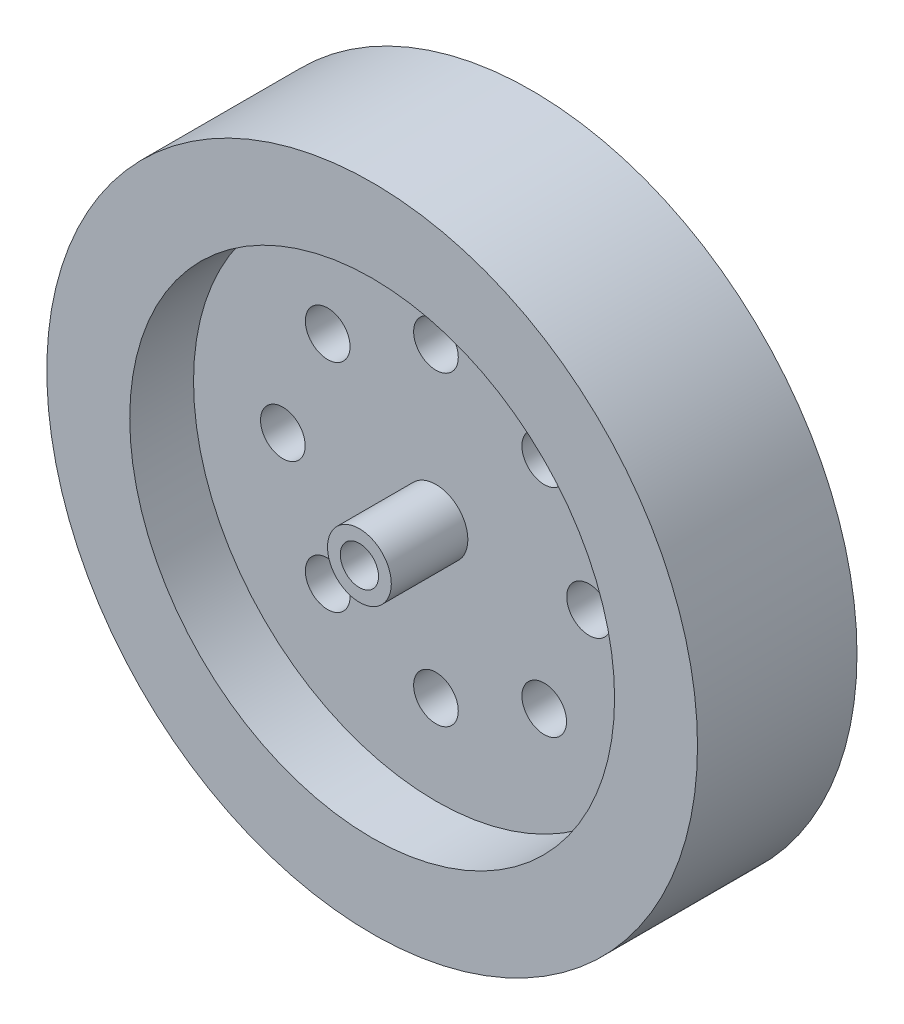
from build123d import *

# Parameters (mm, degrees)
SKETCH_1_R          = 51
EXTRUDE_1_DEPTH     = 25
SKETCH_1_3_R        = 3.5
SKETCH_1_3_R_2      = 3
CUT_EXTRUDE_1_DEPTH = 25
SKETCH_1_4_R        = 38
CUT_EXTRUDE_2_DEPTH = 10
CUT_EXTRUDE_START   = -15
SKETCH_1_5_R        = 38
CUT_EXTRUDE_3_DEPTH = 10
EXTRUDE_START       = 12
SKETCH_2_R          = 5
SKETCH_2_R_2        = 3
EXTRUDE_2_DEPTH     = 12


with BuildPart() as part:
    # 스케치1 → 보스-돌출1 (new body)
    with BuildSketch(Plane.XY):
        Circle(SKETCH_1_R)
    extrude(amount=-EXTRUDE_1_DEPTH)

    # 스케치1<3> → 컷-돌출1 (cut)
    with BuildSketch(Plane.XY):
        with Locations((0, -24)):
            Circle(SKETCH_1_3_R)
        with Locations((-16.970562748, 16.970562748)):
            Circle(SKETCH_1_3_R)
        with Locations((0, 24)):
            Circle(SKETCH_1_3_R)
        with Locations((16.970562748, 16.970562748)):
            Circle(SKETCH_1_3_R)
        with Locations((24, 0)):
            Circle(SKETCH_1_3_R)
        with Locations((16.970562748, -16.970562748)):
            Circle(SKETCH_1_3_R)
        with Locations((-16.970562748, -16.970562748)):
            Circle(SKETCH_1_3_R)
        with Locations((-24, 0)):
            Circle(SKETCH_1_3_R)
        Circle(SKETCH_1_3_R_2)
    extrude(amount=-CUT_EXTRUDE_1_DEPTH, mode=Mode.SUBTRACT)

    # 스케치1<4> → 컷-돌출2 (cut)
    with BuildSketch(Plane.XY):
        Circle(SKETCH_1_4_R)
    extrude(amount=-CUT_EXTRUDE_2_DEPTH, mode=Mode.SUBTRACT)

    # 스케치1<5> → 컷-돌출3 (cut)
    with BuildSketch(Plane.XY.offset(CUT_EXTRUDE_START)):
        Circle(SKETCH_1_5_R)
    extrude(amount=-CUT_EXTRUDE_3_DEPTH, mode=Mode.SUBTRACT)

    # 스케치2 → 보스-돌출2 (add)
    with BuildSketch(Plane.XY.offset(-10).offset(EXTRUDE_START)):
        Circle(SKETCH_2_R)
        Circle(SKETCH_2_R_2, mode=Mode.SUBTRACT)
    extrude(amount=-EXTRUDE_2_DEPTH)


solid = part.part
